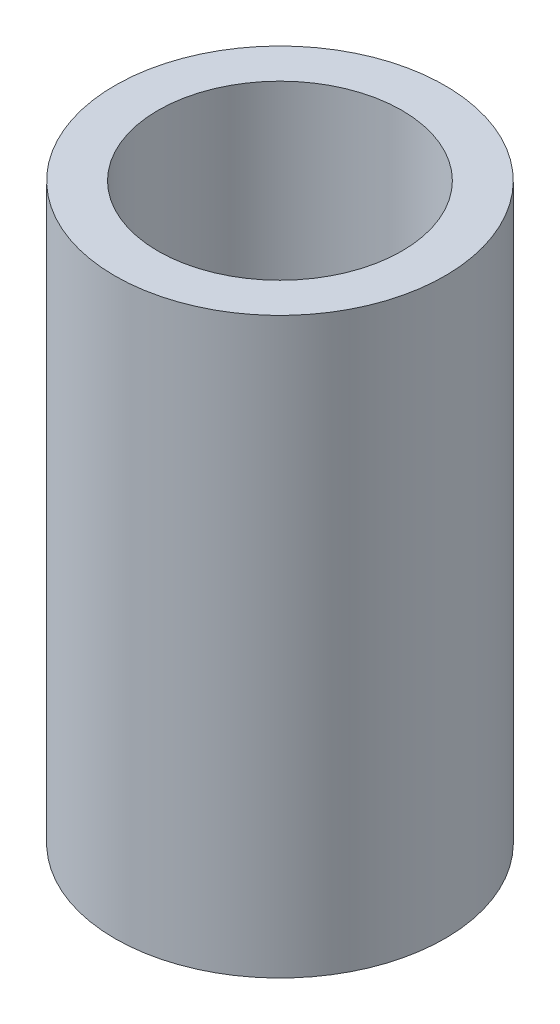
from build123d import *

# Parameters (mm, degrees)
SKETCH1_R           = 5.75
SKETCH1_R_2         = 4.25
BOSS_EXTRUDE1_DEPTH = 20


with BuildPart() as part:
    # Sketch1 → Boss-Extrude1 (new body)
    with BuildSketch(Plane(origin=(0, 0, 0), x_dir=(1, 0, 0), z_dir=(0, 1, 0))):
        with Locations(Location((0, 0, 0), (0, 0, 270))):
            Circle(SKETCH1_R)
        with Locations(Location((0, 0, 0), (0, 0, 270))):
            Circle(SKETCH1_R_2, mode=Mode.SUBTRACT)
    extrude(amount=BOSS_EXTRUDE1_DEPTH)


solid = part.part
